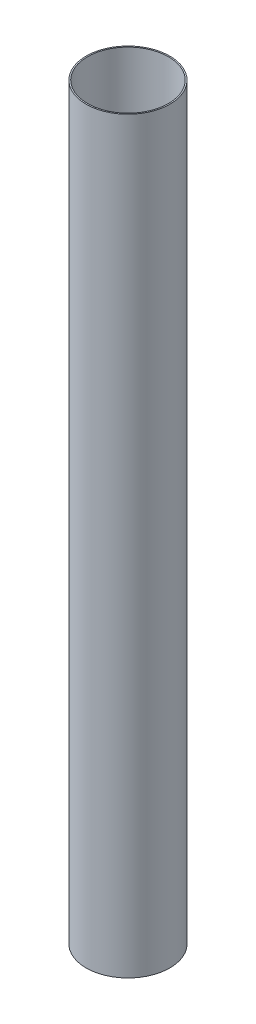
from build123d import *

# Parameters (mm, degrees)
SKETCH1_R           = 51.105
BOSS_EXTRUDE1_DEPTH = 914.4
SKETCH3_R           = 49.53
CUT_EXTRUDE1_DEPTH  = 918.251765902


with BuildPart() as part:
    # Sketch1 → Boss-Extrude1 (new body)
    with BuildSketch(Plane(origin=(0, 0, 0), x_dir=(1, 0, 0), z_dir=(0, 1, 0))):
        with Locations(Location((0, 0, 0), (0, 0, 270))):
            Circle(SKETCH1_R)
    extrude(amount=BOSS_EXTRUDE1_DEPTH)

    # Sketch3 → Cut-Extrude1 (cut, through all)
    with BuildSketch(Plane.XZ):
        with Locations(Location((0, 0, 0), (0, 0, 270))):
            Circle(SKETCH3_R)
    extrude(amount=-CUT_EXTRUDE1_DEPTH, mode=Mode.SUBTRACT)


solid = part.part
